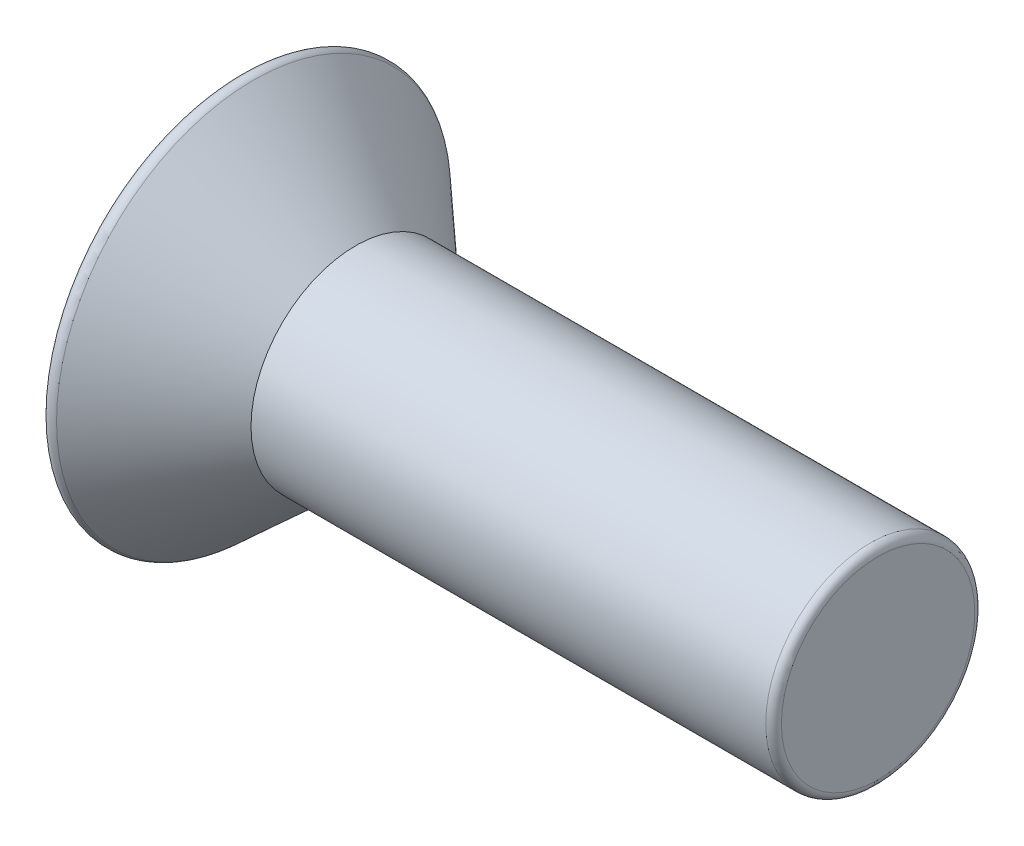
from build123d import *

# Parameters (mm, degrees)
KES_EKSTR_ZYON1_DEPTH = 5
RADYUS2_R             = 0.3


with BuildPart() as part:
    # Çizim1 → Döndür1 (revolve)
    with BuildSketch(Plane.XY, mode=Mode.PRIVATE) as d_nd_r1_sk:
        Polygon((0, 0), (0, 4), (-20, 4), (-24.4, 8), (-24.4, 0), align=None)
    revolve(d_nd_r1_sk.sketch.rotate(Axis((-24.4, 0, 0), (1, 0, 0)), 90), axis=Axis((-24.4, 0, 0), (1, 0, 0)))

    # Çizim2 → Kes-Ekstrüzyon1 (cut)
    with BuildSketch(Plane.ZY.offset(24.4)):
        Polygon((2.886751346, 0), (1.443375673, 2.5), (-1.443375673, 2.5), (-2.886751346, 0), (-1.443375673, -2.5), (1.443375673, -2.5), align=None)
    extrude(amount=-KES_EKSTR_ZYON1_DEPTH, mode=Mode.SUBTRACT)

    # Radyus2
    radyus2_edges = [part.edges().sort_by_distance(p)[0] for p in [
        (-24.4, 0, -8),
        (0, 0, -4),
    ]]
    fillet(radyus2_edges, radius=RADYUS2_R)


solid = part.part
